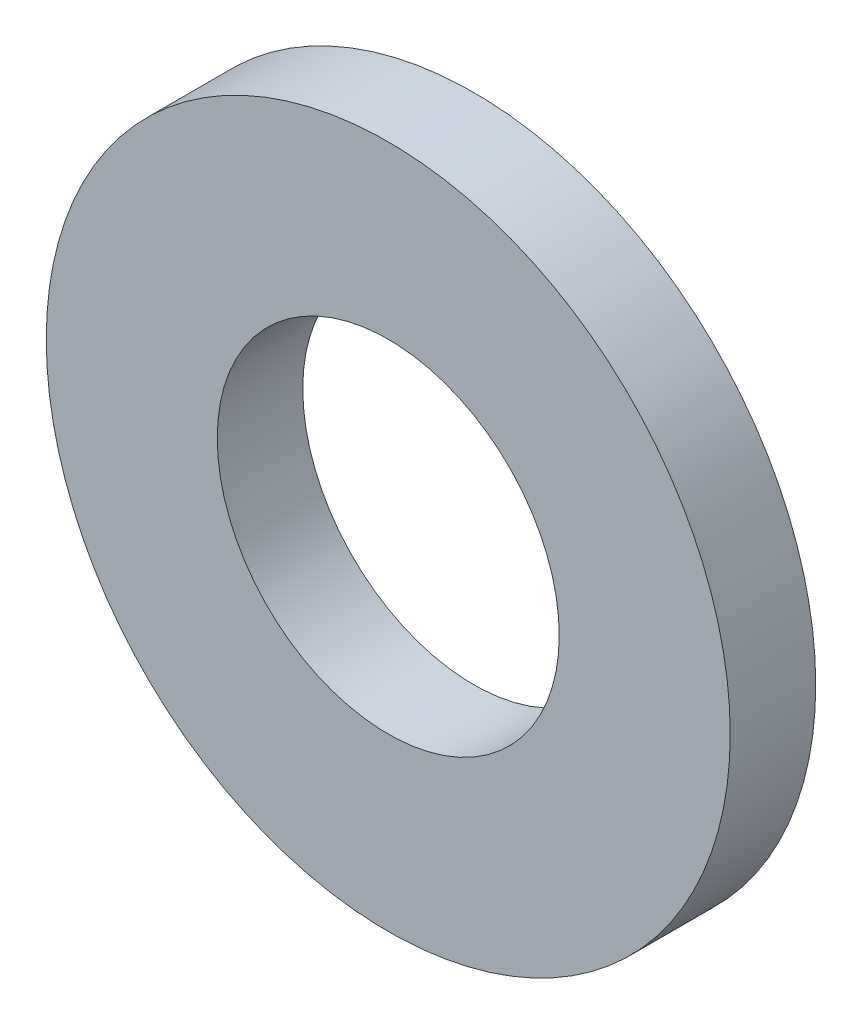
from build123d import *

# Parameters (mm, degrees)
SKICA1_R                = 6
SKICA1_R_2              = 3
P_IDAT_VYSUNUT_M1_DEPTH = 1.5


with BuildPart() as part:
    # Skica1 → Přidat vysunutím1 (new body)
    with BuildSketch(Plane.XY):
        Circle(SKICA1_R)
        Circle(SKICA1_R_2, mode=Mode.SUBTRACT)
    extrude(amount=P_IDAT_VYSUNUT_M1_DEPTH)


solid = part.part
